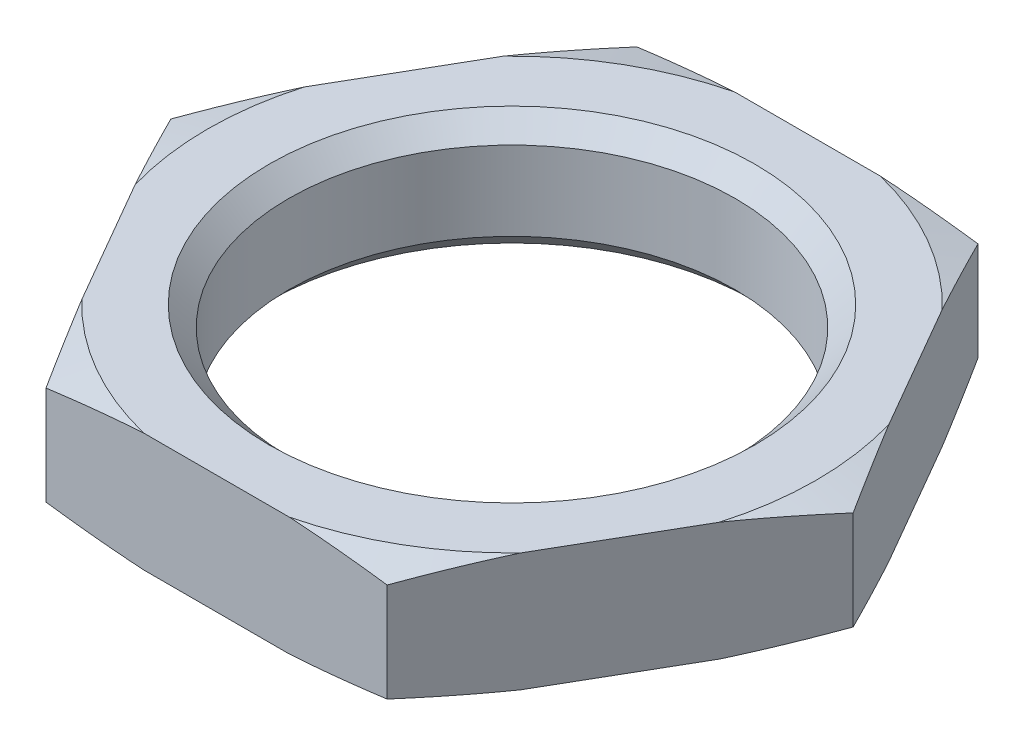
from build123d import *

# Parameters (mm, degrees)
ESQUISSE1_R          = 11.3
BASE_EXTRUSION_DEPTH = 3
CHANFREIN1_SIZE      = 1


with BuildPart() as part:
    # Esquisse1 → Base-Extrusion (new, symmetric)
    with BuildSketch(Plane(origin=(0, 0, 0), x_dir=(1, 0, 0), z_dir=(0, 1, 0))):
        Polygon((8.631386524, 14.95), (17.262773049, 0), (8.631386524, -14.95), (-8.631386524, -14.95), (-17.262773049, 0), (-8.631386524, 14.95), align=None)
        with Locations(Location((0, 0, 0), (0, 0, 90))):
            Circle(ESQUISSE1_R, mode=Mode.SUBTRACT)
    extrude(amount=BASE_EXTRUSION_DEPTH, both=True)

    # Chanfrein1
    chanfrein1_edges = [part.edges().sort_by_distance(p)[0] for p in [
        (0, 3, 11.3),
        (0, -3, 11.3),
    ]]
    chamfer(chanfrein1_edges, length=CHANFREIN1_SIZE)

    # Esquisse2 → Enlèvement de matière-Révolution3 (revolve, cut)
    with BuildSketch(Plane.XY):
        Polygon((15.396747645, 3), (17.262773049, 2.5), (17.262773049, 3), align=None)
        Polygon((17.262773049, -3), (15.396747645, -3), (17.262773049, -2.5), align=None)
    revolve(axis=Axis((0, 0, 0), (0, -1, 0)), mode=Mode.SUBTRACT)


solid = part.part
